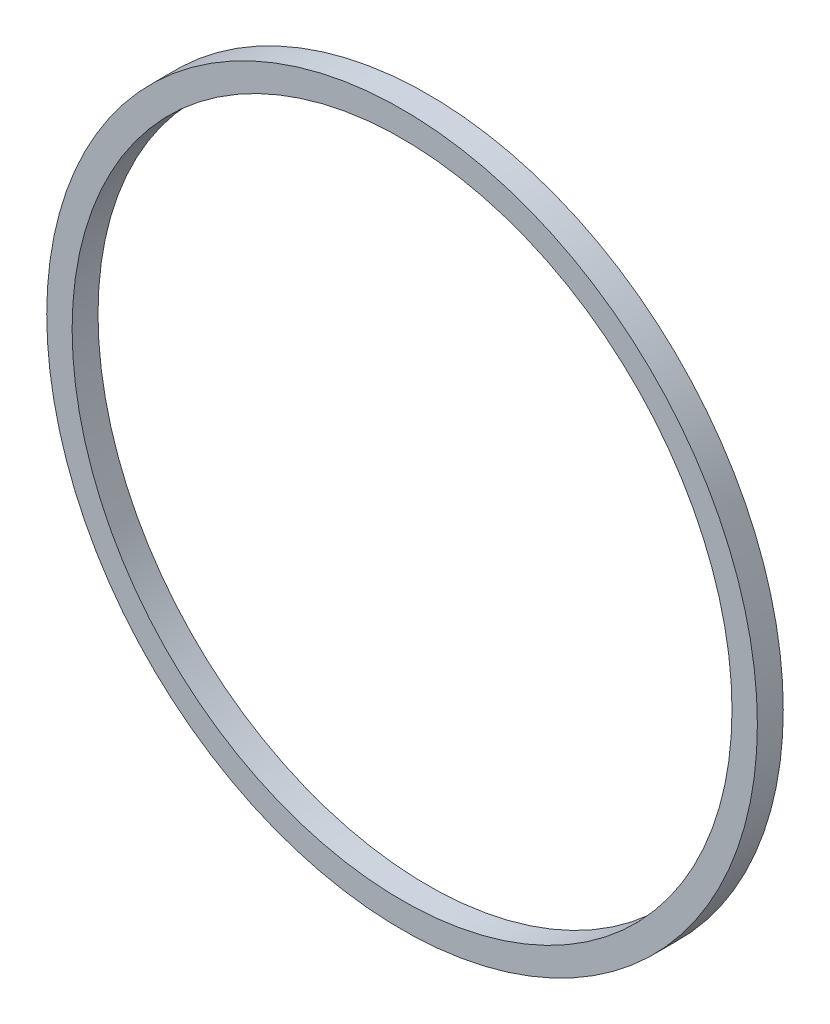
from build123d import *

# Parameters (mm, degrees)
SKETCH1_R           = 70
SKETCH1_R_2         = 65
BOSS_EXTRUDE1_DEPTH = 5.1


with BuildPart() as part:
    # Sketch1 → Boss-Extrude1 (new body)
    with BuildSketch(Plane.XY):
        Circle(SKETCH1_R)
        Circle(SKETCH1_R_2, mode=Mode.SUBTRACT)
    extrude(amount=BOSS_EXTRUDE1_DEPTH)


solid = part.part
